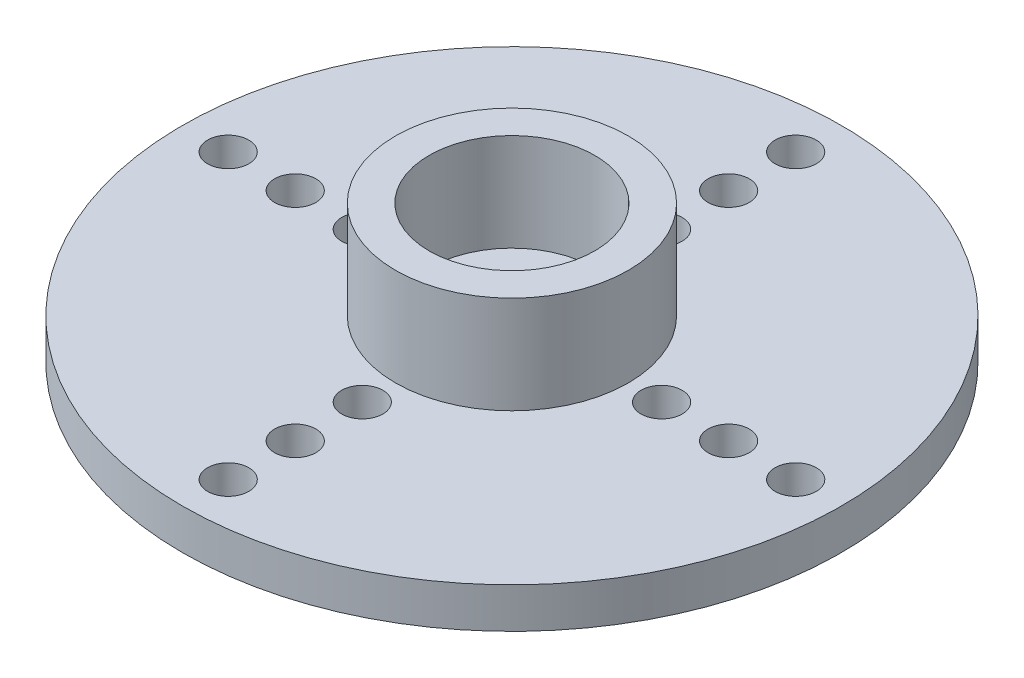
from build123d import *

# Parameters (mm, degrees)
SKETCH1_R           = 9.9568
BOSS_EXTRUDE1_DEPTH = 1.2192
SKETCH2_R           = 3.5179
SKETCH2_R_2         = 2.5019
BOSS_EXTRUDE2_DEPTH = 2.9464
SKETCH3_R           = 1.0795
SKETCH3_R_2         = 0.6223
CUT_EXTRUDE1_DEPTH  = 15.386000328


with BuildPart() as part:
    # Sketch1 → Boss-Extrude1 (new body)
    with BuildSketch(Plane(origin=(0, 0, 0), x_dir=(1, 0, 0), z_dir=(0, 1, 0))):
        with Locations(Location((0, 0, 0), (0, 0, 270))):
            Circle(SKETCH1_R)
    extrude(amount=BOSS_EXTRUDE1_DEPTH)

    # Sketch2 → Boss-Extrude2 (add)
    with BuildSketch(Plane(origin=(0, 1.2192, 0), x_dir=(1, 0, 0), z_dir=(0, 1, 0))):
        with Locations(Location((0, 0, 0), (0, 0, 270))):
            Circle(SKETCH2_R)
        with Locations(Location((0, 0, 0), (0, 0, 270))):
            Circle(SKETCH2_R_2, mode=Mode.SUBTRACT)
    extrude(amount=BOSS_EXTRUDE2_DEPTH)

    # Sketch3 → Cut-Extrude1 (cut, through all)
    with BuildSketch(Plane(origin=(0, 1.2192, 0), x_dir=(1, 0, 0), z_dir=(0, 1, 0))):
        with Locations(Location((0, 0, 0), (0, 0, 270))):
            Circle(SKETCH3_R)
        with Locations(Location((-4.5212, 0, 0), (0, 0, 270))):
            Circle(SKETCH3_R_2)
        with Locations(Location((-6.54685, 0, 0), (0, 0, 270))):
            Circle(SKETCH3_R_2)
        with Locations(Location((-8.5725, 0, 0), (0, 0, 270))):
            Circle(SKETCH3_R_2)
        with Locations(Location((8.5725, 0, 0), (0, 0, 90))):
            Circle(SKETCH3_R_2)
        with Locations(Location((6.54685, 0, 0), (0, 0, 90))):
            Circle(SKETCH3_R_2)
        with Locations(Location((4.5212, 0, 0), (0, 0, 90))):
            Circle(SKETCH3_R_2)
        with Locations(Location((0, 4.5212, 0), (0, 0, 270))):
            Circle(SKETCH3_R_2)
        with Locations(Location((0, 6.54685, 0), (0, 0, 270))):
            Circle(SKETCH3_R_2)
        with Locations(Location((0, 8.5725, 0), (0, 0, 270))):
            Circle(SKETCH3_R_2)
        with Locations(Location((0, -4.5212, 0), (0, 0, 90))):
            Circle(SKETCH3_R_2)
        with Locations(Location((0, -6.54685, 0), (0, 0, 90))):
            Circle(SKETCH3_R_2)
        with Locations(Location((0, -8.5725, 0), (0, 0, 90))):
            Circle(SKETCH3_R_2)
    extrude(amount=-CUT_EXTRUDE1_DEPTH, mode=Mode.SUBTRACT)


solid = part.part
